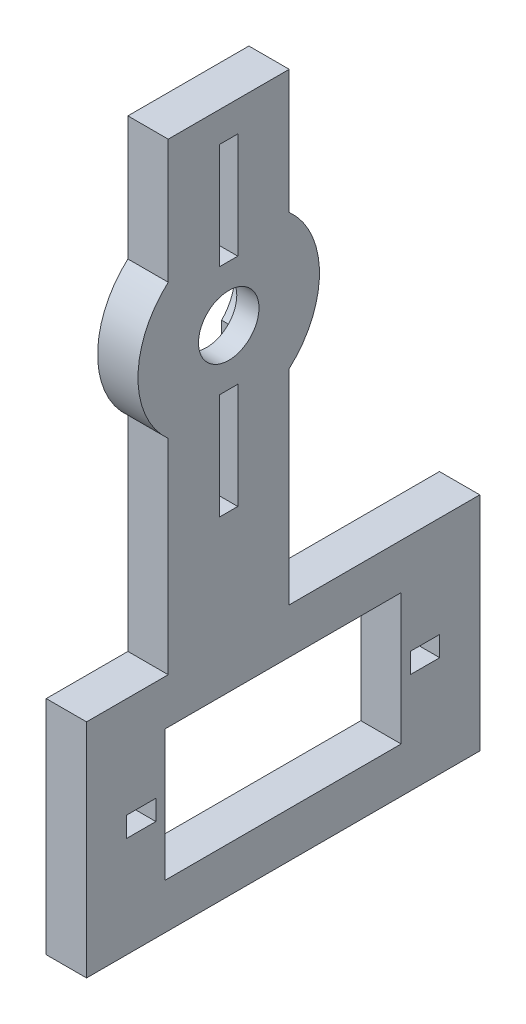
from build123d import *

# Parameters (mm, degrees)
BOSS_EXTRUDE1_START  = 55.6
SKETCH1_R            = 9
BOSS_EXTRUDE1_DEPTH  = 4
BOSS_EXTRUDE2_START  = 60
SKETCH2_W            = 4
SKETCH2_H            = 49
BOSS_EXTRUDE2_DEPTH  = 12
BOSS_EXTRUDE3_START  = 41.1
SKETCH3_W            = 4
SKETCH3_H            = 22
BOSS_EXTRUDE3_DEPTH  = 39
BOSS_EXTRUDE4_START  = 55.1
SKETCH4_R            = 4.6
BOSS_EXTRUDE4_DEPTH  = 2.3
BOSS_EXTRUDE5_START  = 62.7
SKETCH5_W            = 2.3
SKETCH5_H            = 17.5
BOSS_EXTRUDE5_DEPTH  = 6.6
BOSS_EXTRUDE6_START  = 65.1
SKETCH6_W            = 6
SKETCH6_H            = 10.5
BOSS_EXTRUDE6_DEPTH  = 1.8
BOSS_EXTRUDE7_START  = 62.7
SKETCH7_W            = 2.3
SKETCH7_H            = 17.5
BOSS_EXTRUDE7_DEPTH  = 6.6
BOSS_EXTRUDE8_START  = 65.1
SKETCH8_W            = 6
SKETCH8_H            = 10.5
BOSS_EXTRUDE8_DEPTH  = 1.8
BOSS_EXTRUDE9_START  = 54.6
SKETCH9_R            = 3
BOSS_EXTRUDE9_DEPTH  = 6
BOSS_EXTRUDE10_START = 48.9
SKETCH10_W           = 6
SKETCH10_H           = 13
BOSS_EXTRUDE10_DEPTH = 23.4
BOSS_EXTRUDE11_START = 45.075
SKETCH11_W           = 6
SKETCH11_H           = 2
BOSS_EXTRUDE11_DEPTH = 2.9
BOSS_EXTRUDE12_START = 73.225
SKETCH12_W           = 6
SKETCH12_H           = 2
BOSS_EXTRUDE12_DEPTH = 2.9


with BuildPart() as part:
    # Sketch1 → Boss-Extrude1 (new body)
    with BuildSketch(Plane(origin=(0, 0, 0), x_dir=(0, 0, -1), z_dir=(1, 0, 0)).offset(BOSS_EXTRUDE1_START)):
        with Locations((-66, 18)):
            Circle(SKETCH1_R)
    extrude(amount=BOSS_EXTRUDE1_DEPTH)

    # Sketch2 → Boss-Extrude2 (add)
    with BuildSketch(Plane.XY.offset(BOSS_EXTRUDE2_START)):
        with Locations((57.6, 12.5)):
            Rectangle(SKETCH2_W, SKETCH2_H)
    extrude(amount=BOSS_EXTRUDE2_DEPTH)

    # Sketch3 → Boss-Extrude3 (add)
    with BuildSketch(Plane.XY.offset(BOSS_EXTRUDE3_START)):
        with Locations((57.6, -20)):
            Rectangle(SKETCH3_W, SKETCH3_H)
    extrude(amount=BOSS_EXTRUDE3_DEPTH)


with BuildPart() as body_2:
    # Sketch4 → Boss-Extrude4 (new body)
    with BuildSketch(Plane(origin=(0, 0, 0), x_dir=(0, 0, -1), z_dir=(1, 0, 0)).offset(BOSS_EXTRUDE4_START)):
        with Locations((-66, 18)):
            Circle(SKETCH4_R)
    extrude(amount=BOSS_EXTRUDE4_DEPTH)


with BuildPart() as part_1:
    add(part.part)

    # Combine1: cut body 2
    add(body_2.part, mode=Mode.SUBTRACT)


with BuildPart() as body_2_2:
    # Sketch5 → Boss-Extrude5 (new body)
    with BuildSketch(Plane.XY.offset(BOSS_EXTRUDE5_START)):
        with Locations((56.25, 26.75)):
            Rectangle(SKETCH5_W, SKETCH5_H)
    extrude(amount=BOSS_EXTRUDE5_DEPTH)


with BuildPart() as part_2:
    add(part_1.part)

    # Combine2: cut body 2 2
    add(body_2_2.part, mode=Mode.SUBTRACT)


with BuildPart() as body_2_3:
    # Sketch6 → Boss-Extrude6 (new body)
    with BuildSketch(Plane.XY.offset(BOSS_EXTRUDE6_START)):
        with Locations((57.6, 28.75)):
            Rectangle(SKETCH6_W, SKETCH6_H)
    extrude(amount=BOSS_EXTRUDE6_DEPTH)


with BuildPart() as part_3:
    add(part_2.part)

    # Combine3: cut body 2 3
    add(body_2_3.part, mode=Mode.SUBTRACT)


with BuildPart() as body_2_4:
    # Sketch7 → Boss-Extrude7 (new body)
    with BuildSketch(Plane.XY.offset(BOSS_EXTRUDE7_START)):
        with Locations((56.25, 9.25)):
            Rectangle(SKETCH7_W, SKETCH7_H)
    extrude(amount=BOSS_EXTRUDE7_DEPTH)


with BuildPart() as part_4:
    add(part_3.part)

    # Combine4: cut body 2 4
    add(body_2_4.part, mode=Mode.SUBTRACT)


with BuildPart() as body_2_5:
    # Sketch8 → Boss-Extrude8 (new body)
    with BuildSketch(Plane.XY.offset(BOSS_EXTRUDE8_START)):
        with Locations((57.6, 7.25)):
            Rectangle(SKETCH8_W, SKETCH8_H)
    extrude(amount=BOSS_EXTRUDE8_DEPTH)


with BuildPart() as part_5:
    add(part_4.part)

    # Combine5: cut body 2 5
    add(body_2_5.part, mode=Mode.SUBTRACT)


with BuildPart() as body_2_6:
    # Sketch9 → Boss-Extrude9 (new body)
    with BuildSketch(Plane(origin=(0, 0, 0), x_dir=(0, 0, -1), z_dir=(1, 0, 0)).offset(BOSS_EXTRUDE9_START)):
        with Locations((-66, 18)):
            Circle(SKETCH9_R)
    extrude(amount=BOSS_EXTRUDE9_DEPTH)


with BuildPart() as part_6:
    add(part_5.part)

    # Combine6: cut body 2 6
    add(body_2_6.part, mode=Mode.SUBTRACT)


with BuildPart() as body_2_7:
    # Sketch10 → Boss-Extrude10 (new body)
    with BuildSketch(Plane.XY.offset(BOSS_EXTRUDE10_START)):
        with Locations((57.6, -20)):
            Rectangle(SKETCH10_W, SKETCH10_H)
    extrude(amount=BOSS_EXTRUDE10_DEPTH)


with BuildPart() as part_7:
    add(part_6.part)

    # Combine7: cut body 2 7
    add(body_2_7.part, mode=Mode.SUBTRACT)


with BuildPart() as body_2_8:
    # Sketch11 → Boss-Extrude11 (new body)
    with BuildSketch(Plane.XY.offset(BOSS_EXTRUDE11_START)):
        with Locations((57.6, -20)):
            Rectangle(SKETCH11_W, SKETCH11_H)
    extrude(amount=BOSS_EXTRUDE11_DEPTH)


with BuildPart() as part_8:
    add(part_7.part)

    # Combine8: cut body 2 8
    add(body_2_8.part, mode=Mode.SUBTRACT)


with BuildPart() as body_2_9:
    # Sketch12 → Boss-Extrude12 (new body)
    with BuildSketch(Plane.XY.offset(BOSS_EXTRUDE12_START)):
        with Locations((57.6, -20)):
            Rectangle(SKETCH12_W, SKETCH12_H)
    extrude(amount=BOSS_EXTRUDE12_DEPTH)


with BuildPart() as part_9:
    add(part_8.part)

    # Combine9: cut body 2 9
    add(body_2_9.part, mode=Mode.SUBTRACT)


solid = part_9.part
